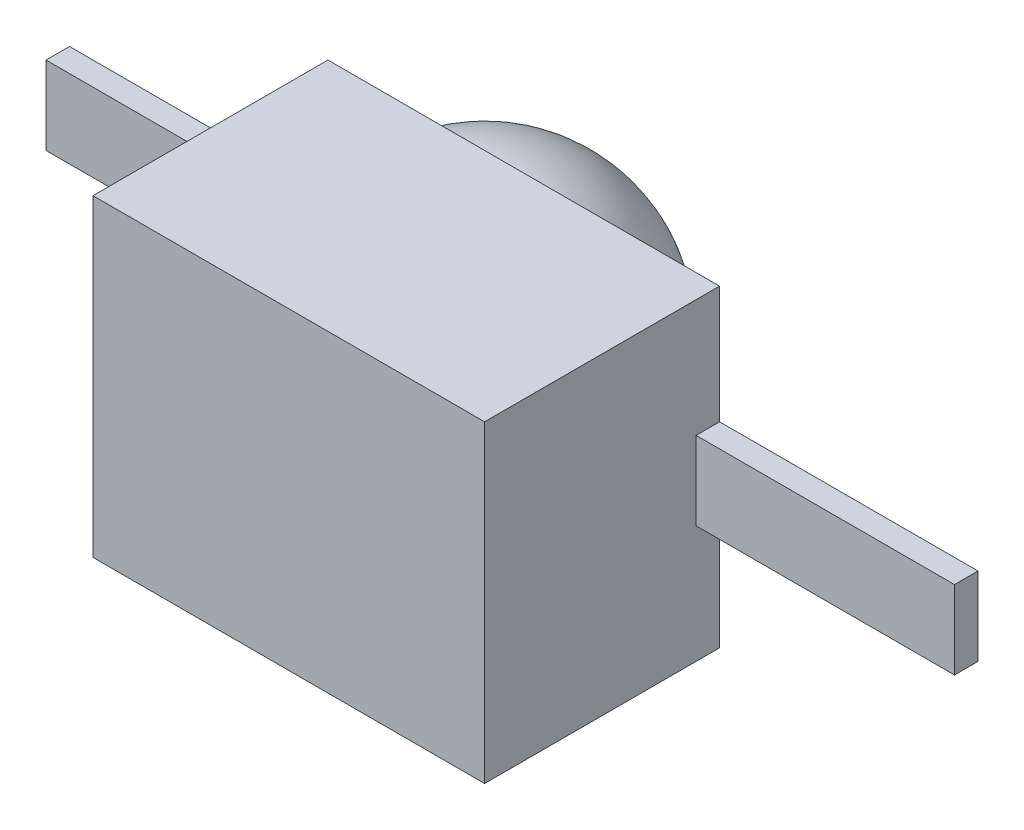
from build123d import *

# Parameters (mm, degrees)
SKETCH_1_W      = 2.5
SKETCH_1_H      = 2
EXTRUDE_1_DEPTH = 1.5
SKETCH_2_W      = 0.15
SKETCH_2_H      = 0.5
EXTRUDE_2_DEPTH = 1.65
SKETCH_3_W      = 0.15
SKETCH_3_H      = 0.5
EXTRUDE_3_DEPTH = 1.65


with BuildPart() as part:
    # Эскиз1 → Бобышка-Вытянуть1 (new body)
    with BuildSketch(Plane.XY):
        Rectangle(SKETCH_1_W, SKETCH_1_H)
    extrude(amount=EXTRUDE_1_DEPTH)

    # Эскиз2 → Бобышка-Вытянуть2 (add)
    with BuildSketch(Plane(origin=(1.25, 0, 0), x_dir=(0, 0, -1), z_dir=(1, 0, 0))):
        with Locations((-0.075, 0)):
            Rectangle(SKETCH_2_W, SKETCH_2_H)
    extrude(amount=EXTRUDE_2_DEPTH)

    # Эскиз3 → Бобышка-Вытянуть3 (add)
    with BuildSketch(Plane.ZY.offset(1.25)):
        with Locations((0.075, 0)):
            Rectangle(SKETCH_3_W, SKETCH_3_H)
    extrude(amount=EXTRUDE_3_DEPTH)

    # Эскиз4 → Повернуть1 (revolve)
    with BuildSketch(Plane(origin=(0, 0, 0), x_dir=(-1, 0, 0), z_dir=(0, 0, -1))):
        with BuildLine():
            Line((1.2, 0), (-0.7, 0))
            ThreePointArc((-0.7, 0), (0.25, 0.95), (1.2, 0))
        make_face()
    revolve(axis=Axis((-1.2, 0, 0), (1, 0, 0)))


solid = part.part
